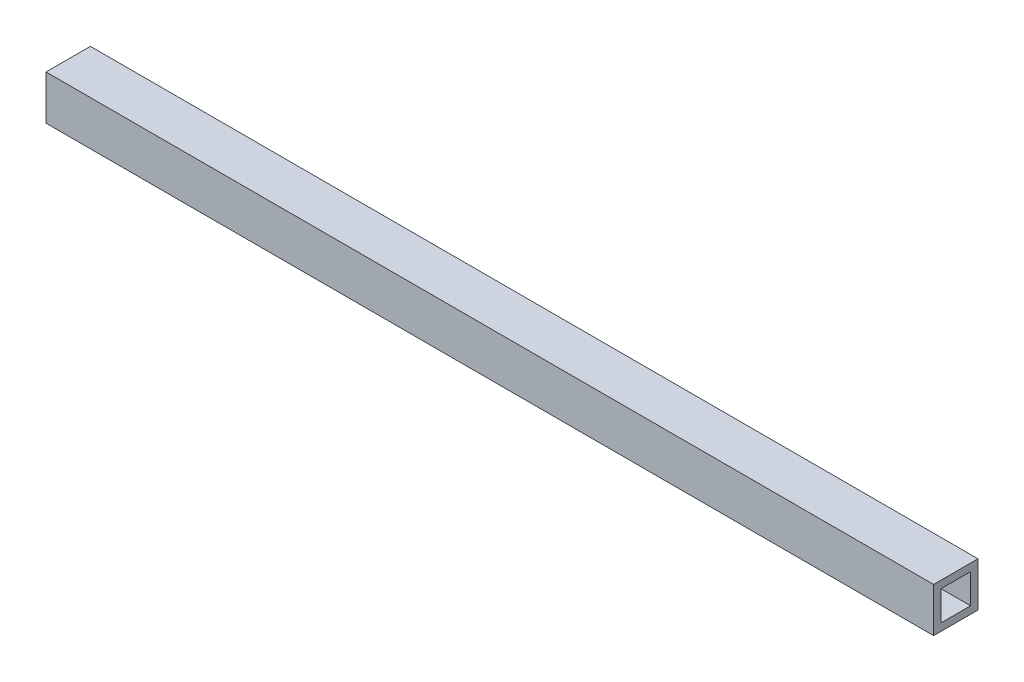
from build123d import *

# Parameters (mm, degrees)
SKETCH1_W           = 19.05
SKETCH1_H           = 19.05
SKETCH1_W_2         = 12.7
SKETCH1_H_2         = 12.7
BOSS_EXTRUDE1_DEPTH = 190.5


with BuildPart() as part:
    # Sketch1 → Boss-Extrude1 (new, symmetric)
    with BuildSketch(Plane(origin=(0, 0, 0), x_dir=(0, 0, -1), z_dir=(1, 0, 0))):
        Rectangle(SKETCH1_W, SKETCH1_H)
        Rectangle(SKETCH1_W_2, SKETCH1_H_2, mode=Mode.SUBTRACT)
    extrude(amount=BOSS_EXTRUDE1_DEPTH, both=True)


solid = part.part
